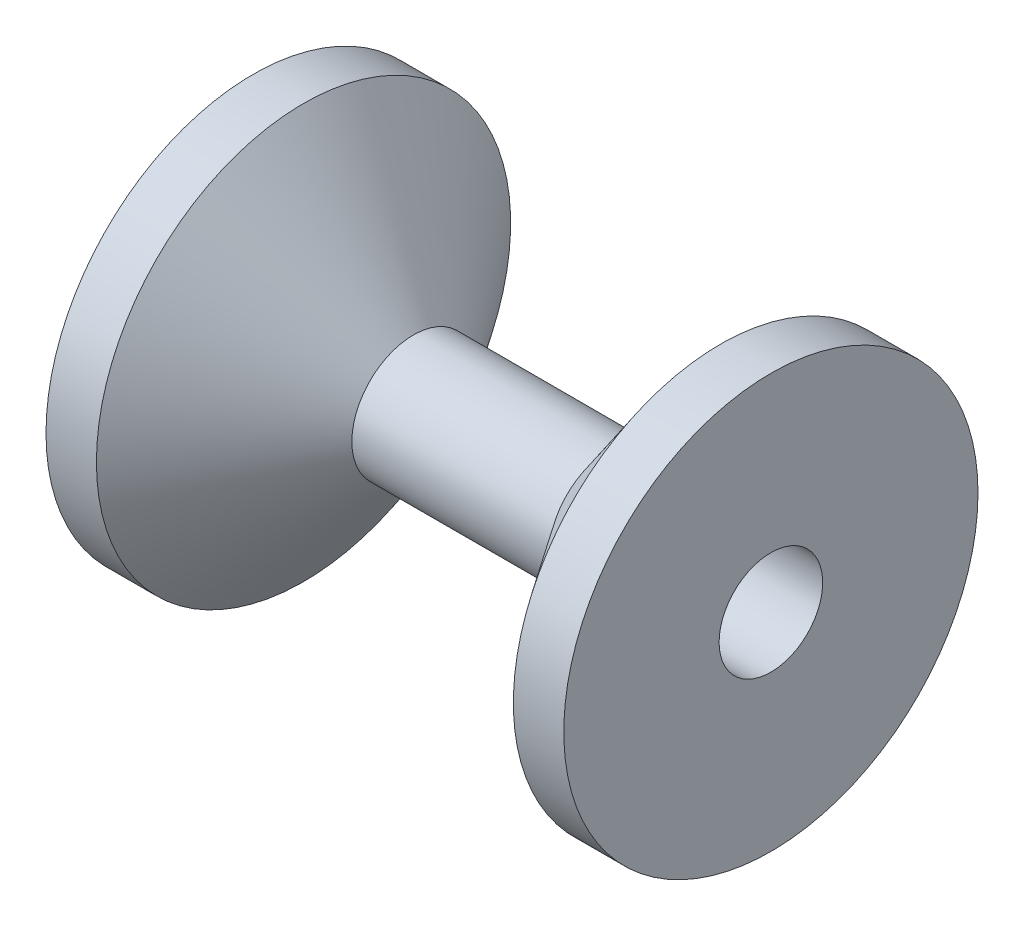
from build123d import *

# Parameters (mm, degrees)
SKETCH1_R           = 40
BOSS_EXTRUDE1_DEPTH = 100
SKETCH3_R           = 10
CUT_EXTRUDE1_DEPTH  = 115.891252931


with BuildPart() as part:
    # Sketch1 → Boss-Extrude1 (new body)
    with BuildSketch(Plane(origin=(0, 0, 0), x_dir=(0, 0, -1), z_dir=(1, 0, 0))):
        Circle(SKETCH1_R)
    extrude(amount=BOSS_EXTRUDE1_DEPTH)

    # Sketch2 → Cut-Revolve1 (revolve, cut)
    with BuildSketch(Plane(origin=(0, 0, 0), x_dir=(1, 0, 0), z_dir=(0, 1, 0)), mode=Mode.PRIVATE) as cut_revolve1_sk:
        Polygon((9.736892583, 40), (30.975149321, 11.906444473), (69.024850679, 11.906444473), (90.263107417, 40), align=None)
    revolve(cut_revolve1_sk.sketch.rotate(Axis((0, 0, 0), (1, 0, 0)), 180), axis=Axis((0, 0, 0), (1, 0, 0)), mode=Mode.SUBTRACT)

    # Sketch3 → Cut-Extrude1 (cut, through all)
    with BuildSketch(Plane.ZY):
        Circle(SKETCH3_R)
    extrude(amount=-CUT_EXTRUDE1_DEPTH, mode=Mode.SUBTRACT)


solid = part.part
